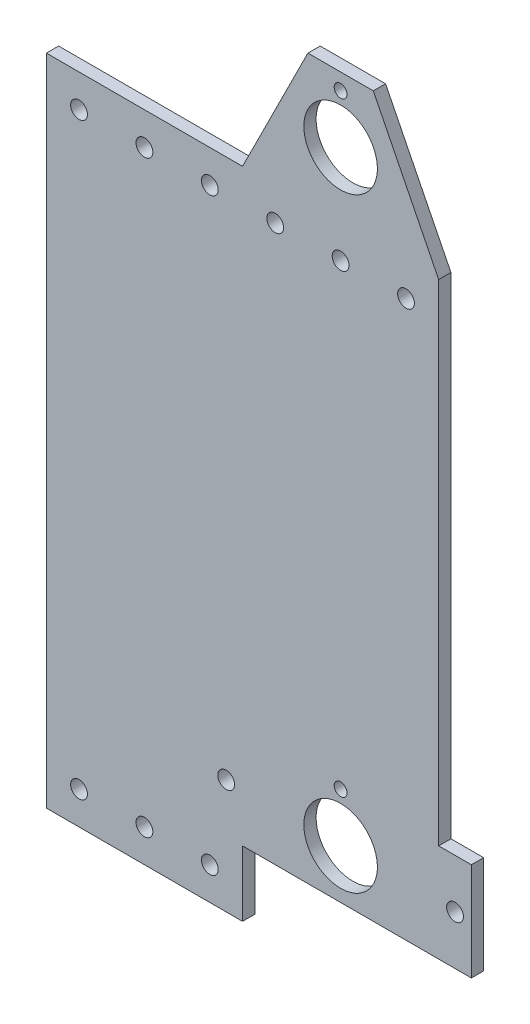
from build123d import *

# Parameters (mm, degrees)
SKETCH1_R           = 3.2639
SKETCH1_R_2         = 14.2875
SKETCH1_R_3         = 2.4892
BOSS_EXTRUDE1_DEPTH = 4.7625


with BuildPart() as part:
    # Sketch1 → Boss-Extrude1 (new body)
    with BuildSketch(Plane.XY):
        Polygon((76.2, 0), (76.2, 25.4), (50.8, 76.2), (25.4, 76.2), (0, 25.4), (-76.2, 25.4), (-76.2, 0), (-76.2, -215.9), (-76.2, -228.6), (0, -228.6), (0, -203.2), (38.1, -203.2), (88.9, -203.2), (88.9, -165.1), (76.2, -165.1), align=None)
        with Locations(Location((-38.1, 12.7, 0), (0, 0, 180))):
            Circle(SKETCH1_R, mode=Mode.SUBTRACT)
        with Locations(Location((-12.7, 12.7, 0), (0, 0, 180))):
            Circle(SKETCH1_R, mode=Mode.SUBTRACT)
        with Locations(Location((-63.5, 12.7, 0), (0, 0, 180))):
            Circle(SKETCH1_R, mode=Mode.SUBTRACT)
        with Locations(Location((12.7, 12.7, 0), (0, 0, 180))):
            Circle(SKETCH1_R, mode=Mode.SUBTRACT)
        with Locations(Location((38.1, 12.7, 0), (0, 0, 180))):
            Circle(SKETCH1_R, mode=Mode.SUBTRACT)
        with Locations(Location((38.1, 50.8, 0), (0, 0, 180))):
            Circle(SKETCH1_R_2, mode=Mode.SUBTRACT)
        with Locations(Location((63.5, 12.7, 0), (0, 0, 180))):
            Circle(SKETCH1_R, mode=Mode.SUBTRACT)
        with Locations(Location((38.1, -184.15, 0), (0, 0, 180))):
            Circle(SKETCH1_R_2, mode=Mode.SUBTRACT)
        with Locations(Location((38.1, -165.1, 0), (0, 0, 180))):
            Circle(SKETCH1_R_3, mode=Mode.SUBTRACT)
        with Locations(Location((-12.7, -215.9, 0), (0, 0, 180))):
            Circle(SKETCH1_R, mode=Mode.SUBTRACT)
        with Locations(Location((-38.1, -215.9, 0), (0, 0, 180))):
            Circle(SKETCH1_R, mode=Mode.SUBTRACT)
        with Locations(Location((-63.5, -215.9, 0), (0, 0, 180))):
            Circle(SKETCH1_R, mode=Mode.SUBTRACT)
        with Locations(Location((38.1, 69.85, 0), (0, 0, 180))):
            Circle(SKETCH1_R_3, mode=Mode.SUBTRACT)
        with Locations(Location((82.55, -184.15, 0), (0, 0, 180))):
            Circle(SKETCH1_R, mode=Mode.SUBTRACT)
        with Locations(Location((-6.35, -184.15, 0), (0, 0, 180))):
            Circle(SKETCH1_R, mode=Mode.SUBTRACT)
    extrude(amount=BOSS_EXTRUDE1_DEPTH)


solid = part.part
